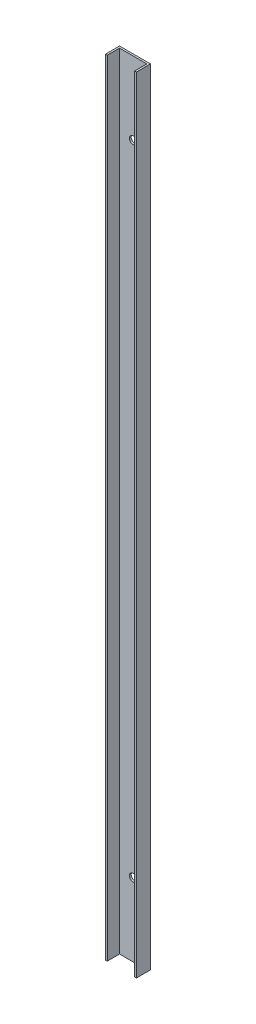
from build123d import *

# Parameters (mm, degrees)
EXTRUDE_THIN1_DEPTH = 430
SKETCH2_R           = 2.1
CUT_EXTRUDE1_DEPTH  = 10


with BuildPart() as part:
    # Sketch1 → Extrude-Thin1 (new body)
    with BuildSketch(Plane(origin=(0, 0, 0), x_dir=(1, 0, 0), z_dir=(0, 1, 0))):
        Polygon((-10.945454545, 0), (-10.945454545, 7.7), (6.054545455, 7.7), (6.054545455, 0), (5.054545455, 0), (5.054545455, 6.7), (-9.945454545, 6.7), (-9.945454545, 0), align=None)
    extrude(amount=EXTRUDE_THIN1_DEPTH)

    # Sketch2 → Cut-Extrude1 (cut)
    with BuildSketch(Plane.XY.offset(-6.7)):
        with Locations((-2.445454545, 390)):
            Circle(SKETCH2_R)
        with Locations(Location((-2.445454545, 40, 0), (0, 0, 180))):
            Circle(SKETCH2_R)
    extrude(amount=-CUT_EXTRUDE1_DEPTH, mode=Mode.SUBTRACT)


solid = part.part
